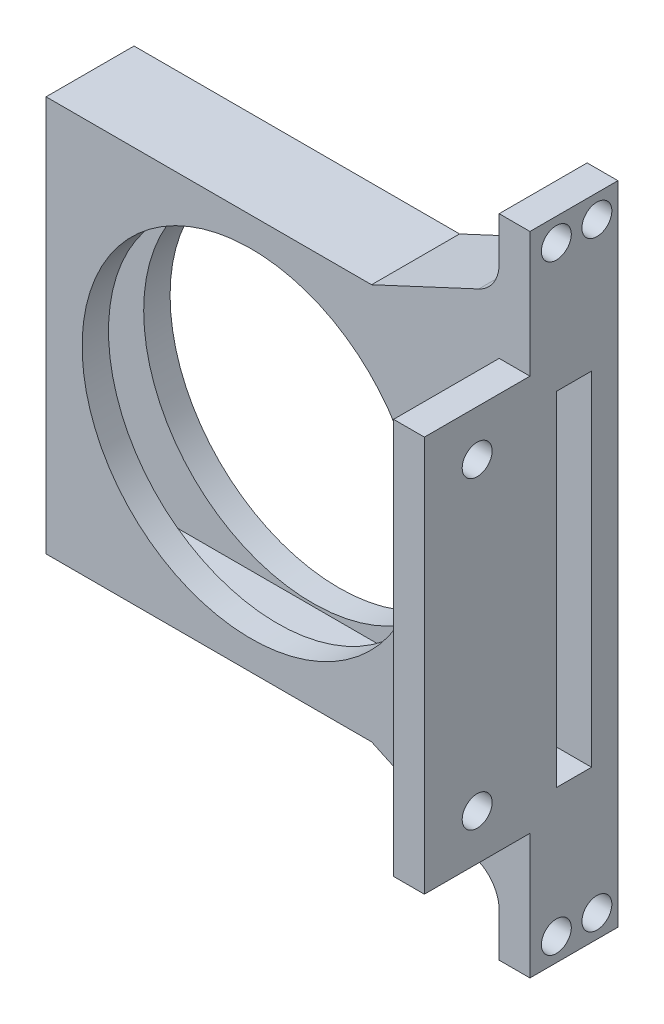
from build123d import *

# Parameters (mm, degrees)
SKETCH_1_W          = 55
SKETCH_1_H          = 45
EXTRUDE_1_DEPTH     = 3
SKETCH_2_W          = 3.5
SKETCH_2_H          = 45
EXTRUDE_2_DEPTH     = 12
SKETCH_3_R          = 1.7
CUT_EXTRUDE_1_DEPTH = 59.167860542
EXTRUDE_START       = -7
EXTRUDE_3_DEPTH     = 10
SKETCH_6_R          = 1.7
CUT_EXTRUDE_2_DEPTH = 66.018535195
SKETCH_7_R          = 19.2
CUT_EXTRUDE_3_DEPTH = 48.438485631
SKETCH_10_W         = 55
SKETCH_10_H         = 4
EXTRUDE_9_DEPTH     = 3


with BuildPart() as part:
    # 草图1 → 凸台-拉伸1 (new body)
    with BuildSketch(Plane.XY):
        Rectangle(SKETCH_1_W, SKETCH_1_H)
    extrude_1 = extrude(amount=EXTRUDE_1_DEPTH)

    # 草图2 → 凸台-拉伸2 (add)
    with BuildSketch(Plane.XY.offset(3)):
        with Locations((25.75, 0)):
            Rectangle(SKETCH_2_W, SKETCH_2_H)
    extrude(amount=EXTRUDE_2_DEPTH)

    # 草图3 → 切除-拉伸1 (cut, through all)
    with BuildSketch(Plane.ZY.offset(-24)):
        with Locations(Location((9, -17.3, 0), (0, 0, 270))):
            Circle(SKETCH_3_R)
        with Locations(Location((9, 17.3, 0), (0, 0, 270))):
            Circle(SKETCH_3_R)
    extrude(amount=-CUT_EXTRUDE_1_DEPTH, mode=Mode.SUBTRACT)

    # 草图5 → 凸台-拉伸3 (add)
    with BuildSketch(Plane.XY.offset(EXTRUDE_START)):
        with BuildLine():
            Line((27.5, -22.5), (9.5, -22.5))
            Line((9.5, -22.5), (21.689237996, -28.178880611))
            ThreePointArc((21.689237996, -28.178880611), (23.373199667, -29.654914404), (24, -31.804687417))
            Line((24, -31.804687417), (24, -36.744522299))
            Line((24, -36.744522299), (27.5, -36.744522299))
            Line((27.5, -36.744522299), (27.5, -22.5))
        make_face()
    extrude_3 = extrude(amount=EXTRUDE_3_DEPTH)

    # 草图6 → 切除-拉伸2 (cut, through all)
    with BuildSketch(Plane.ZY.offset(-24)):
        with Locations((0, -34.129434576)):
            Circle(SKETCH_6_R)
        with Locations((-4.607898424, -34.129434576)):
            Circle(SKETCH_6_R)
    cut_extrude_2 = extrude(amount=-CUT_EXTRUDE_2_DEPTH, mode=Mode.SUBTRACT)

    # 镜向3: 凸台-拉伸3, 切除-拉伸2 across plane
    add(extrude_3.mirror(Plane.ZX))
    add(cut_extrude_2.mirror(Plane.ZX), mode=Mode.SUBTRACT)

    # 草图7 → 切除-拉伸3 (cut, symmetric)
    with BuildSketch(Plane.XY.offset(3)):
        with Locations((-4.204977357, 0)):
            Circle(SKETCH_7_R)
    cut_extrude_3 = extrude(amount=CUT_EXTRUDE_3_DEPTH, both=True, mode=Mode.SUBTRACT)

    # 镜向6: 凸台-拉伸1, 切除-拉伸3 across plane
    add(extrude_1.mirror(Plane.XY.offset(-2)))
    add(cut_extrude_3.mirror(Plane.XY.offset(-2)), mode=Mode.SUBTRACT)

    # 草图10 → 凸台-拉伸9 (add)
    with BuildSketch(Plane(origin=(0, -22.5, 0), x_dir=(-1, 0, 0), z_dir=(0, -1, 0))):
        with Locations((0, 2)):
            Rectangle(SKETCH_10_W, SKETCH_10_H)
    extrude_9 = extrude(amount=-EXTRUDE_9_DEPTH)

    # 镜向7: 凸台-拉伸9 across plane
    add(extrude_9.mirror(Plane.ZX))


solid = part.part
